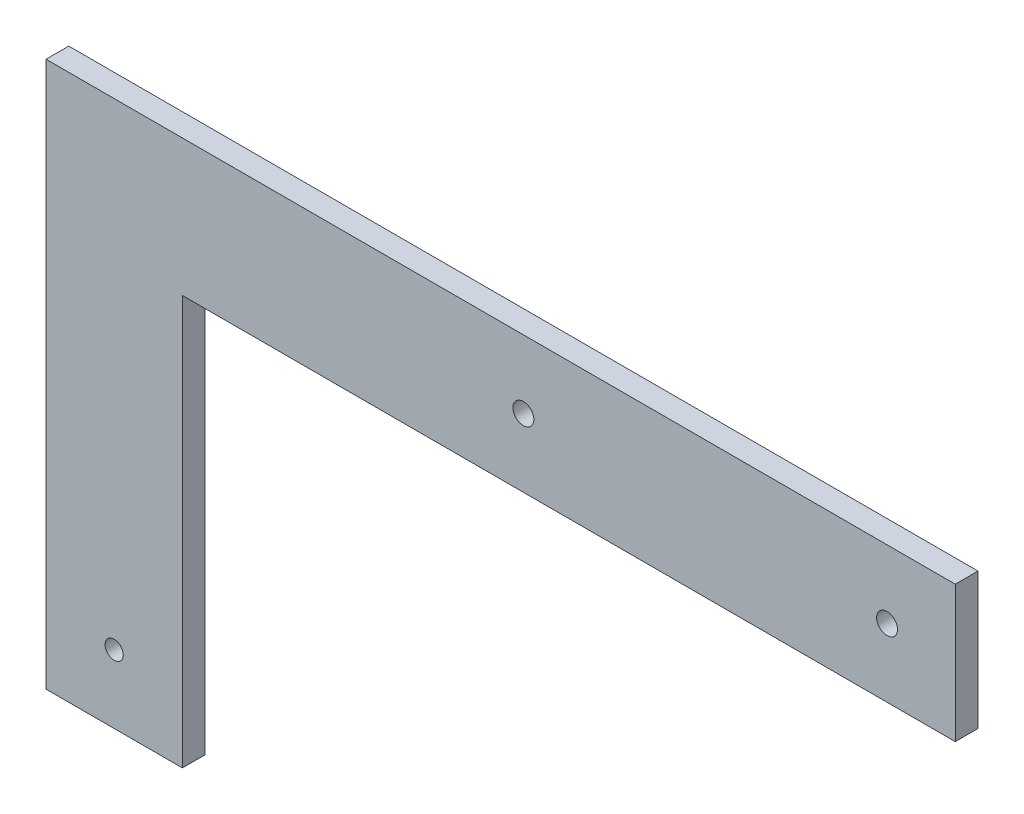
from build123d import *

# Parameters (mm, degrees)
BOSS_EXTRUDE1_DEPTH = 3.175
SKETCH2_R           = 1.27
SKETCH2_R_2         = 1.4605
CUT_EXTRUDE1_DEPTH  = 149.140205971


with BuildPart() as part:
    # Sketch1 → Boss-Extrude1 (new body)
    with BuildSketch(Plane.XY):
        Polygon((0, 0), (0, 76.2), (127, 76.2), (127, 57.15), (19.05, 57.15), (19.05, 0), align=None)
    extrude(amount=BOSS_EXTRUDE1_DEPTH)

    # Sketch2 → Cut-Extrude1 (cut, through all)
    with BuildSketch(Plane.XY.offset(3.175)):
        with Locations((9.525, 9.525)):
            Circle(SKETCH2_R)
        with Locations((117.475, 66.675)):
            Circle(SKETCH2_R_2)
        with Locations((66.675, 66.675)):
            Circle(SKETCH2_R_2)
    extrude(amount=-CUT_EXTRUDE1_DEPTH, mode=Mode.SUBTRACT)


solid = part.part
